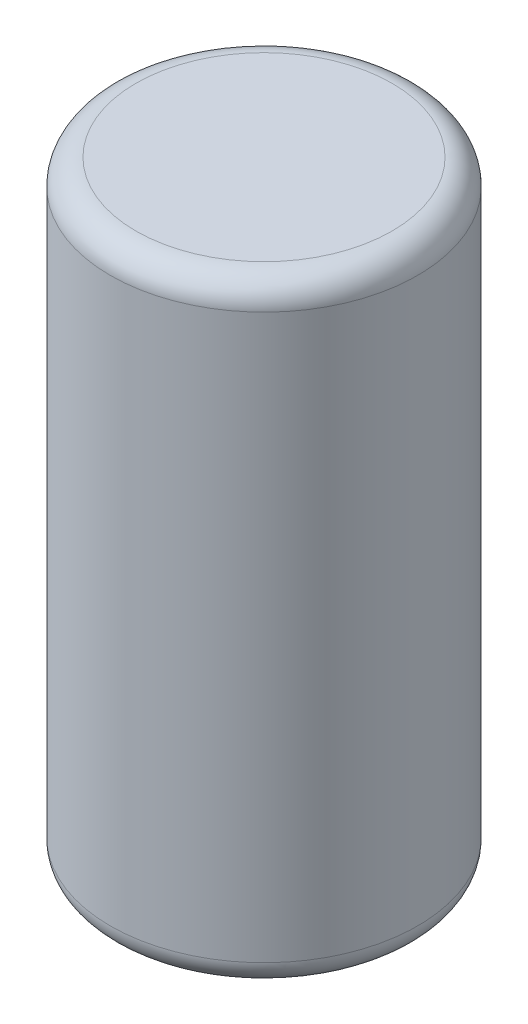
from build123d import *


with BuildPart() as part:
    # Sketch1 → Revolve1 (revolve)
    with BuildSketch(Plane.XY, mode=Mode.PRIVATE) as revolve1_sk:
        with BuildLine():
            Line((0, 6), (0, -6))
            Line((0, -6), (2.5, -6))
            ThreePointArc((2.5, -6), (2.853553391, -5.853553391), (3, -5.5))
            Line((3, -5.5), (3, 5.5))
            ThreePointArc((3, 5.5), (2.853553391, 5.853553391), (2.5, 6))
            Line((2.5, 6), (0, 6))
        make_face()
    revolve(revolve1_sk.sketch.rotate(Axis((0, 6, 0), (0, -1, 0)), 90), axis=Axis((0, 6, 0), (0, -1, 0)))


solid = part.part
